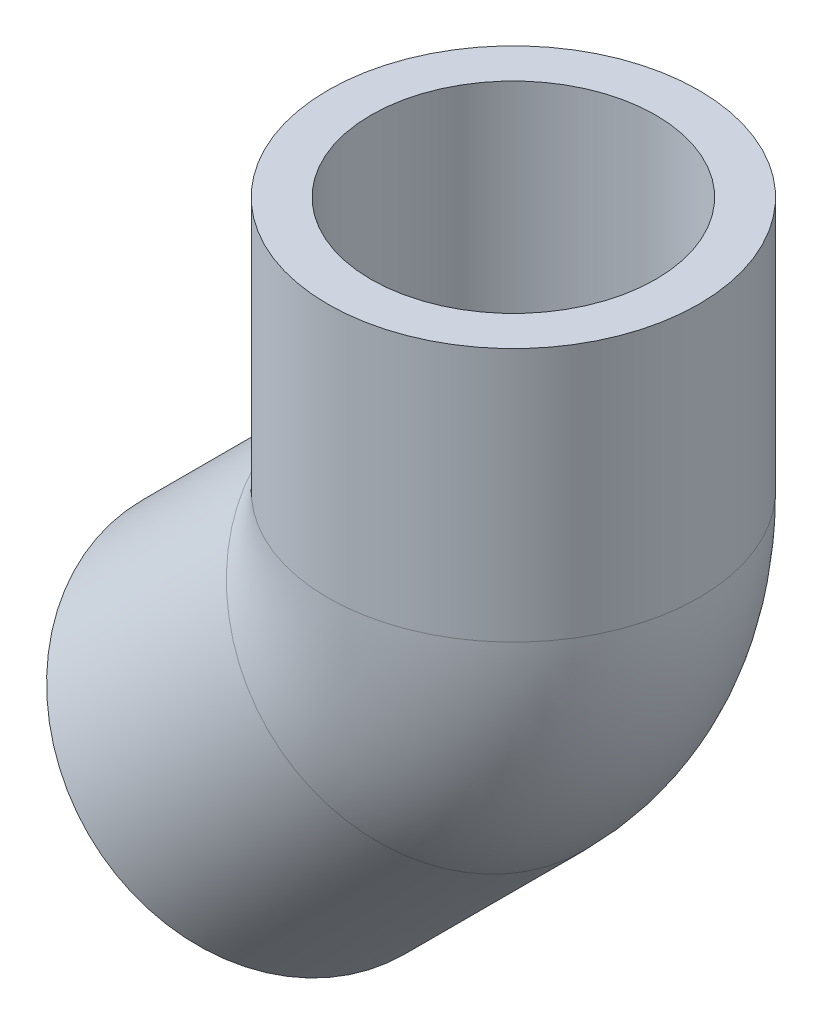
from build123d import *

# Parameters (mm, degrees)
SKETCH2_R          = 13.8938
SKETCH2_R_2        = 7.8994
SKETCH5_R          = 10.668
CUT_EXTRUDE1_DEPTH = 19.05
SKETCH6_R          = 10.668
CUT_EXTRUDE2_DEPTH = 19.05


with BuildPart() as part:
    # Sweep1: sweep along a path in Sketch3
    with BuildLine(Plane.XY) as sweep1_path:
        Line((-17.960512242, -17.960512242), (-4.490128061, -4.490128061))
        ThreePointArc((-4.490128061, -4.490128061), (-1.166946263, 0.483364969), (0, 6.35))
        Line((0, 6.35), (0, 25.4))
    # Sketch2 → Sweep1 (sweep)
    with BuildSketch(Plane(origin=(0, 25.4, 0), x_dir=(1, 0, 0), z_dir=(0, 1, 0))):
        Circle(SKETCH2_R)
        Circle(SKETCH2_R_2, mode=Mode.SUBTRACT)
    sweep(path=sweep1_path.line)

    # Sketch5 → Cut-Extrude1 (cut)
    with BuildSketch(Plane(origin=(0, 25.4, 0), x_dir=(1, 0, 0), z_dir=(0, 1, 0))):
        with Locations(Location((0, 0, 0), (0, 0, 270))):
            Circle(SKETCH5_R)
    extrude(amount=-CUT_EXTRUDE1_DEPTH, mode=Mode.SUBTRACT)

    # Sketch6 → Cut-Extrude2 (cut)
    with BuildSketch(Plane(origin=(-17.960512242, -17.960512242, 0), x_dir=(0, 0, 1), z_dir=(-0.7071067811865408, -0.7071067811865543, 0))):
        with Locations(Location((0, 0, 0), (0, 0, 270))):
            Circle(SKETCH6_R)
    extrude(amount=-CUT_EXTRUDE2_DEPTH, mode=Mode.SUBTRACT)


solid = part.part
